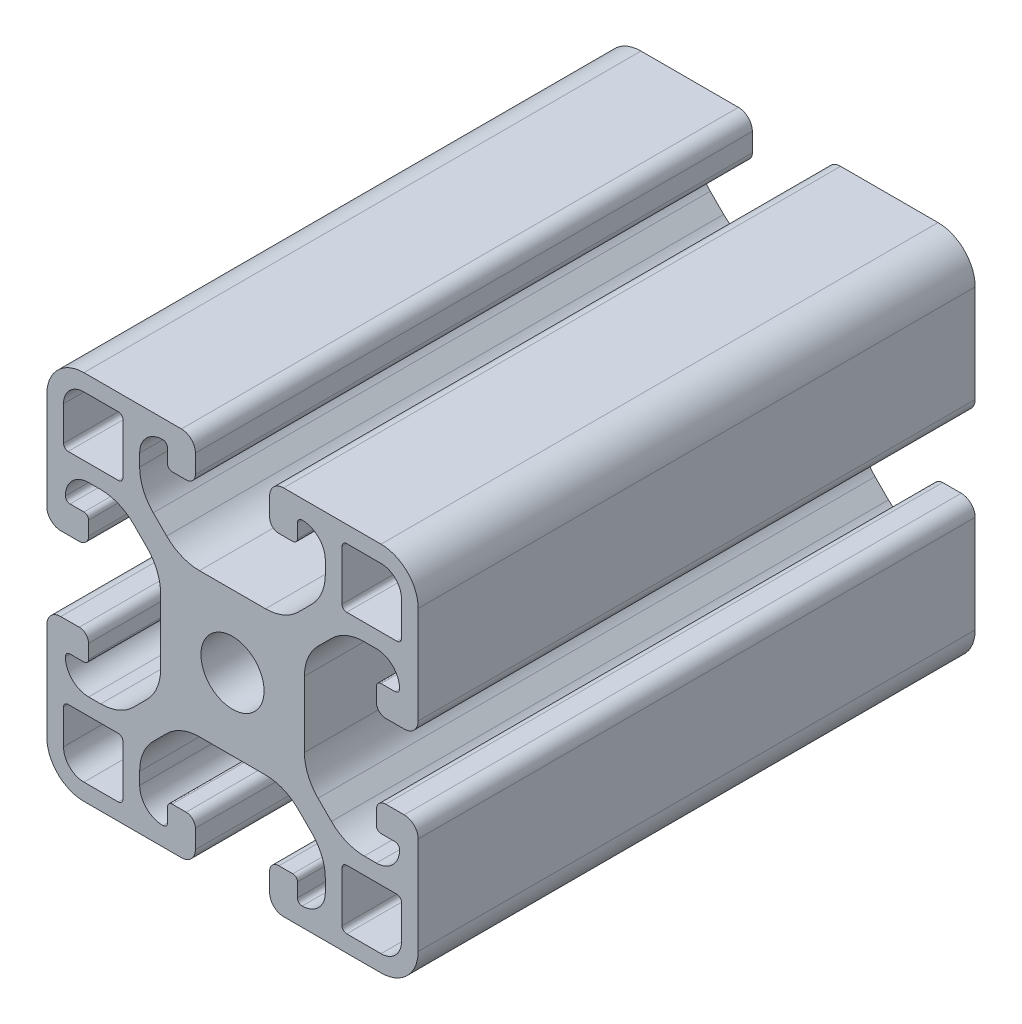
from build123d import *

# Parameters (mm, degrees)
ESQUISSE1_R        = 3.4
BOSS_EXTRU_1_DEPTH = 60


with BuildPart() as part:
    # Esquisse1 → Boss.-Extru.1 (new body)
    with BuildSketch(Plane(origin=(0, 0, -30), x_dir=(-1, 0, 0), z_dir=(0, 0, -1))):
        with BuildLine():
            Line((-4.5, 15), (-4.5, 13.5))
            ThreePointArc((-4.5, 13.5), (-4.353553391, 13.146446609), (-4, 13))
            Line((-4, 13), (-2.5, 13))
            ThreePointArc((-2.5, 13), (-2.146446609, 12.853553391), (-2, 12.5))
            ThreePointArc((-2, 12.5), (-2.732233047, 10.732233047), (-4.5, 10))
            Line((-4.5, 10), (-5.807611845, 10))
            ThreePointArc((-5.807611845, 10), (-7.721029006, 10.380602337), (-9.343145751, 11.464466094))
            Line((-9.343145751, 11.464466094), (-10.785533906, 12.906854249))
            ThreePointArc((-10.785533906, 12.906854249), (-11.869397663, 14.528970994), (-12.25, 16.442388155))
            Line((-12.25, 16.442388155), (-12.25, 23.557611845))
            ThreePointArc((-12.25, 23.557611845), (-11.869397663, 25.471029006), (-10.785533906, 27.093145751))
            Line((-10.785533906, 27.093145751), (-9.343145751, 28.535533906))
            ThreePointArc((-9.343145751, 28.535533906), (-7.721029006, 29.619397663), (-5.807611845, 30))
            Line((-5.807611845, 30), (-4.5, 30))
            ThreePointArc((-4.5, 30), (-2.732233047, 29.267766953), (-2, 27.5))
            ThreePointArc((-2, 27.5), (-2.146446609, 27.146446609), (-2.5, 27))
            Line((-2.5, 27), (-4, 27))
            ThreePointArc((-4, 27), (-4.353553391, 26.853553391), (-4.5, 26.5))
            Line((-4.5, 26.5), (-4.5, 25))
            ThreePointArc((-4.5, 25), (-4.207106781, 24.292893219), (-3.5, 24))
            Line((-3.5, 24), (-1.5, 24))
            ThreePointArc((-1.5, 24), (-0.439339828, 24.439339828), (0, 25.5))
            Line((0, 25.5), (0, 36))
            ThreePointArc((0, 36), (-1.171572875, 38.828427125), (-4, 40))
            Line((-4, 40), (-14.5, 40))
            ThreePointArc((-14.5, 40), (-15.560660172, 39.560660172), (-16, 38.5))
            Line((-16, 38.5), (-16, 36.5))
            ThreePointArc((-16, 36.5), (-15.707106781, 35.792893219), (-15, 35.5))
            Line((-15, 35.5), (-13.5, 35.5))
            ThreePointArc((-13.5, 35.5), (-13.146446609, 35.646446609), (-13, 36))
            Line((-13, 36), (-13, 37.5))
            ThreePointArc((-13, 37.5), (-12.853553391, 37.853553391), (-12.5, 38))
            ThreePointArc((-12.5, 38), (-10.732233047, 37.267766953), (-10, 35.5))
            Line((-10, 35.5), (-10, 34.192388155))
            ThreePointArc((-10, 34.192388155), (-10.380602337, 32.278970994), (-11.464466094, 30.656854249))
            Line((-11.464466094, 30.656854249), (-12.906854249, 29.214466094))
            ThreePointArc((-12.906854249, 29.214466094), (-14.528970994, 28.130602337), (-16.442388155, 27.75))
            Line((-16.442388155, 27.75), (-23.557611845, 27.75))
            ThreePointArc((-23.557611845, 27.75), (-25.471029006, 28.130602337), (-27.093145751, 29.214466094))
            Line((-27.093145751, 29.214466094), (-28.535533906, 30.656854249))
            ThreePointArc((-28.535533906, 30.656854249), (-29.619397663, 32.278970994), (-30, 34.192388155))
            Line((-30, 34.192388155), (-30, 35.5))
            ThreePointArc((-30, 35.5), (-29.267766953, 37.267766953), (-27.5, 38))
            ThreePointArc((-27.5, 38), (-27.146446609, 37.853553391), (-27, 37.5))
            Line((-27, 37.5), (-27, 36))
            ThreePointArc((-27, 36), (-26.853553391, 35.646446609), (-26.5, 35.5))
            Line((-26.5, 35.5), (-25, 35.5))
            ThreePointArc((-25, 35.5), (-24.292893219, 35.792893219), (-24, 36.5))
            Line((-24, 36.5), (-24, 38.5))
            ThreePointArc((-24, 38.5), (-24.439339828, 39.560660172), (-25.5, 40))
            Line((-25.5, 40), (-36, 40))
            ThreePointArc((-36, 40), (-38.828427125, 38.828427125), (-40, 36))
            Line((-40, 36), (-40, 25.5))
            ThreePointArc((-40, 25.5), (-39.560660172, 24.439339828), (-38.5, 24))
            Line((-38.5, 24), (-36.5, 24))
            ThreePointArc((-36.5, 24), (-35.792893219, 24.292893219), (-35.5, 25))
            Line((-35.5, 25), (-35.5, 26.5))
            ThreePointArc((-35.5, 26.5), (-35.646446609, 26.853553391), (-36, 27))
            Line((-36, 27), (-37.5, 27))
            ThreePointArc((-37.5, 27), (-37.853553391, 27.146446609), (-38, 27.5))
            ThreePointArc((-38, 27.5), (-37.267766953, 29.267766953), (-35.5, 30))
            Line((-35.5, 30), (-34.192388155, 30))
            ThreePointArc((-34.192388155, 30), (-32.278970994, 29.619397663), (-30.656854249, 28.535533906))
            Line((-30.656854249, 28.535533906), (-29.214466094, 27.093145751))
            ThreePointArc((-29.214466094, 27.093145751), (-28.130602337, 25.471029006), (-27.75, 23.557611845))
            Line((-27.75, 23.557611845), (-27.75, 16.442388155))
            ThreePointArc((-27.75, 16.442388155), (-28.130602337, 14.528970994), (-29.214466094, 12.906854249))
            Line((-29.214466094, 12.906854249), (-30.656854249, 11.464466094))
            ThreePointArc((-30.656854249, 11.464466094), (-32.278970994, 10.380602337), (-34.192388155, 10))
            Line((-34.192388155, 10), (-35.5, 10))
            ThreePointArc((-35.5, 10), (-37.267766953, 10.732233047), (-38, 12.5))
            ThreePointArc((-38, 12.5), (-37.853553391, 12.853553391), (-37.5, 13))
            Line((-37.5, 13), (-36, 13))
            ThreePointArc((-36, 13), (-35.646446609, 13.146446609), (-35.5, 13.5))
            Line((-35.5, 13.5), (-35.5, 15))
            ThreePointArc((-35.5, 15), (-35.792893219, 15.707106781), (-36.5, 16))
            Line((-36.5, 16), (-38.5, 16))
            ThreePointArc((-38.5, 16), (-39.560660172, 15.560660172), (-40, 14.5))
            Line((-40, 14.5), (-40, 4))
            ThreePointArc((-40, 4), (-38.828427125, 1.171572875), (-36, 0))
            Line((-36, 0), (-25.5, 0))
            ThreePointArc((-25.5, 0), (-24.439339828, 0.439339828), (-24, 1.5))
            Line((-24, 1.5), (-24, 3.5))
            ThreePointArc((-24, 3.5), (-24.292893219, 4.207106781), (-25, 4.5))
            Line((-25, 4.5), (-26.5, 4.5))
            ThreePointArc((-26.5, 4.5), (-26.853553391, 4.353553391), (-27, 4))
            Line((-27, 4), (-27, 2.5))
            ThreePointArc((-27, 2.5), (-27.146446609, 2.146446609), (-27.5, 2))
            ThreePointArc((-27.5, 2), (-29.267766953, 2.732233047), (-30, 4.5))
            Line((-30, 4.5), (-30, 5.807611845))
            ThreePointArc((-30, 5.807611845), (-29.619397663, 7.721029006), (-28.535533906, 9.343145751))
            Line((-28.535533906, 9.343145751), (-27.093145751, 10.785533906))
            ThreePointArc((-27.093145751, 10.785533906), (-25.471029006, 11.869397663), (-23.557611845, 12.25))
            Line((-23.557611845, 12.25), (-16.442388155, 12.25))
            ThreePointArc((-16.442388155, 12.25), (-14.528970994, 11.869397663), (-12.906854249, 10.785533906))
            Line((-12.906854249, 10.785533906), (-11.464466094, 9.343145751))
            ThreePointArc((-11.464466094, 9.343145751), (-10.380602337, 7.721029006), (-10, 5.807611845))
            Line((-10, 5.807611845), (-10, 4.5))
            ThreePointArc((-10, 4.5), (-10.732233047, 2.732233047), (-12.5, 2))
            ThreePointArc((-12.5, 2), (-12.853553391, 2.146446609), (-13, 2.5))
            Line((-13, 2.5), (-13, 4))
            ThreePointArc((-13, 4), (-13.146446609, 4.353553391), (-13.5, 4.5))
            Line((-13.5, 4.5), (-15, 4.5))
            ThreePointArc((-15, 4.5), (-15.707106781, 4.207106781), (-16, 3.5))
            Line((-16, 3.5), (-16, 1.5))
            ThreePointArc((-16, 1.5), (-15.560660172, 0.439339828), (-14.5, 0))
            Line((-14.5, 0), (-4, 0))
            ThreePointArc((-4, 0), (-1.171572875, 1.171572875), (0, 4))
            Line((0, 4), (0, 14.5))
            ThreePointArc((0, 14.5), (-0.439339828, 15.560660172), (-1.5, 16))
            Line((-1.5, 16), (-3.5, 16))
            ThreePointArc((-3.5, 16), (-4.207106781, 15.707106781), (-4.5, 15))
        make_face()
        with Locations(Location((-20, 20, 0), (0, 0, 180))):
            Circle(ESQUISSE1_R, mode=Mode.SUBTRACT)
        with BuildLine():
            Line((-4, 1.8), (-7.7, 1.8))
            ThreePointArc((-7.7, 1.8), (-8.053553391, 1.946446609), (-8.2, 2.3))
            Line((-8.2, 2.3), (-8.2, 7.7))
            ThreePointArc((-8.2, 7.7), (-8.053553391, 8.053553391), (-7.7, 8.2))
            Line((-7.7, 8.2), (-2.3, 8.2))
            ThreePointArc((-2.3, 8.2), (-1.946446609, 8.053553391), (-1.8, 7.7))
            Line((-1.8, 7.7), (-1.8, 4))
            ThreePointArc((-1.8, 4), (-2.444365081, 2.444365081), (-4, 1.8))
        make_face(mode=Mode.SUBTRACT)
        with BuildLine():
            Line((-38.2, 4), (-38.2, 7.7))
            ThreePointArc((-38.2, 7.7), (-38.053553391, 8.053553391), (-37.7, 8.2))
            Line((-37.7, 8.2), (-32.3, 8.2))
            ThreePointArc((-32.3, 8.2), (-31.946446609, 8.053553391), (-31.8, 7.7))
            Line((-31.8, 7.7), (-31.8, 2.3))
            ThreePointArc((-31.8, 2.3), (-31.946446609, 1.946446609), (-32.3, 1.8))
            Line((-32.3, 1.8), (-36, 1.8))
            ThreePointArc((-36, 1.8), (-37.555634919, 2.444365081), (-38.2, 4))
        make_face(mode=Mode.SUBTRACT)
        with BuildLine():
            Line((-36, 38.2), (-32.3, 38.2))
            ThreePointArc((-32.3, 38.2), (-31.946446609, 38.053553391), (-31.8, 37.7))
            Line((-31.8, 37.7), (-31.8, 32.3))
            ThreePointArc((-31.8, 32.3), (-31.946446609, 31.946446609), (-32.3, 31.8))
            Line((-32.3, 31.8), (-37.7, 31.8))
            ThreePointArc((-37.7, 31.8), (-38.053553391, 31.946446609), (-38.2, 32.3))
            Line((-38.2, 32.3), (-38.2, 36))
            ThreePointArc((-38.2, 36), (-37.555634919, 37.555634919), (-36, 38.2))
        make_face(mode=Mode.SUBTRACT)
        with BuildLine():
            Line((-1.8, 36), (-1.8, 32.3))
            ThreePointArc((-1.8, 32.3), (-1.946446609, 31.946446609), (-2.3, 31.8))
            Line((-2.3, 31.8), (-7.7, 31.8))
            ThreePointArc((-7.7, 31.8), (-8.053553391, 31.946446609), (-8.2, 32.3))
            Line((-8.2, 32.3), (-8.2, 37.7))
            ThreePointArc((-8.2, 37.7), (-8.053553391, 38.053553391), (-7.7, 38.2))
            Line((-7.7, 38.2), (-4, 38.2))
            ThreePointArc((-4, 38.2), (-2.444365081, 37.555634919), (-1.8, 36))
        make_face(mode=Mode.SUBTRACT)
    extrude(amount=-BOSS_EXTRU_1_DEPTH)


solid = part.part
